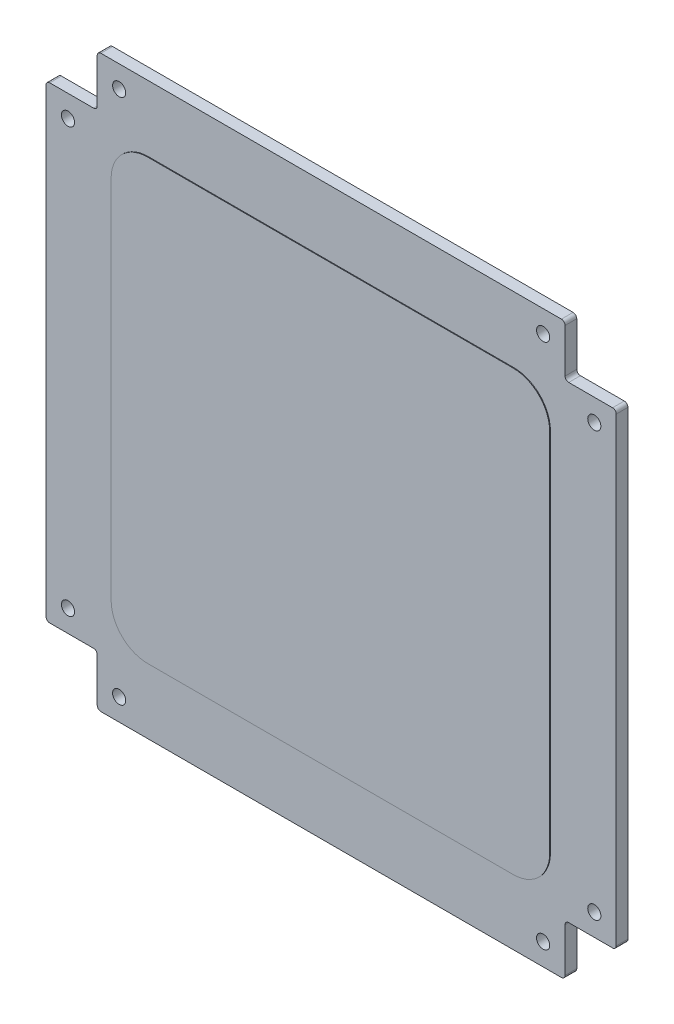
from build123d import *

# Parameters (mm, degrees)
BOSS_EXTRUDE1_DEPTH              = 1.6
BOSS_EXTRUDE2_DEPTH              = 0.1
M1_6_HOLE1_FIXINGSTRUCTURE_D     = 1.8
M1_6_HOLE1_FIXINGSTRUCTURE_DEPTH = 200
M1_6_HOLE1_FIXINGSTRUCTURE_TIP   = 0.540774557


with BuildPart() as part:
    # Sketch1 → Boss-Extrude1 (new body)
    with BuildSketch(Plane.XY):
        with BuildLine():
            Line((-32, 38.5), (-32, 32.5))
            ThreePointArc((-32, 32.5), (-32.146446609, 32.146446609), (-32.5, 32))
            Line((-32.5, 32), (-38.5, 32))
            ThreePointArc((-38.5, 32), (-38.853553391, 31.853553391), (-39, 31.5))
            Line((-39, 31.5), (-39, -31.5))
            ThreePointArc((-39, -31.5), (-38.853553391, -31.853553391), (-38.5, -32))
            Line((-38.5, -32), (-32.5, -32))
            ThreePointArc((-32.5, -32), (-32.146446609, -32.146446609), (-32, -32.5))
            Line((-32, -32.5), (-32, -38.5))
            ThreePointArc((-32, -38.5), (-31.853553391, -38.853553391), (-31.5, -39))
            Line((-31.5, -39), (31.5, -39))
            ThreePointArc((31.5, -39), (31.853553391, -38.853553391), (32, -38.5))
            Line((32, -38.5), (32, -32.5))
            ThreePointArc((32, -32.5), (32.146446609, -32.146446609), (32.5, -32))
            Line((32.5, -32), (38.5, -32))
            ThreePointArc((38.5, -32), (38.853553391, -31.853553391), (39, -31.5))
            Line((39, -31.5), (39, 31.5))
            ThreePointArc((39, 31.5), (38.853553391, 31.853553391), (38.5, 32))
            Line((38.5, 32), (32.5, 32))
            ThreePointArc((32.5, 32), (32.146446609, 32.146446609), (32, 32.5))
            Line((32, 32.5), (32, 38.5))
            ThreePointArc((32, 38.5), (31.853553391, 38.853553391), (31.5, 39))
            Line((31.5, 39), (-31.5, 39))
            ThreePointArc((-31.5, 39), (-31.853553391, 38.853553391), (-32, 38.5))
        make_face()
    extrude(amount=BOSS_EXTRUDE1_DEPTH)

    # Esboço1 → Boss-Extrude2 (add)
    with BuildSketch(Plane.XY.offset(1.6)):
        with BuildLine():
            Line((-25, -30), (25, -30))
            ThreePointArc((25, -30), (28.535533906, -28.535533906), (30, -25))
            Line((30, -25), (30, 25))
            ThreePointArc((30, 25), (28.535533906, 28.535533906), (25, 30))
            Line((25, 30), (-25, 30))
            ThreePointArc((-25, 30), (-28.535533906, 28.535533906), (-30, 25))
            Line((-30, 25), (-30, -25))
            ThreePointArc((-30, -25), (-28.535533906, -28.535533906), (-25, -30))
        make_face()
    extrude(amount=BOSS_EXTRUDE2_DEPTH)

    # M1.6 Hole1-FixingStructure
    with Locations(Plane(origin=(0, 0, 0), x_dir=(-1, 0, 0), z_dir=(0, 0, -1))):
        with Locations((-29, 36), (29, 36), (-29, -36), (29, -36), (36, 29), (36, -29), (-36, -29), (-36, 29)):
            Hole(M1_6_HOLE1_FIXINGSTRUCTURE_D / 2, depth=M1_6_HOLE1_FIXINGSTRUCTURE_DEPTH)
            with Locations((0, 0, -(M1_6_HOLE1_FIXINGSTRUCTURE_DEPTH + M1_6_HOLE1_FIXINGSTRUCTURE_TIP / 2))):  # 118° drill point
                Cone(0, M1_6_HOLE1_FIXINGSTRUCTURE_D / 2, M1_6_HOLE1_FIXINGSTRUCTURE_TIP, mode=Mode.SUBTRACT)


solid = part.part
